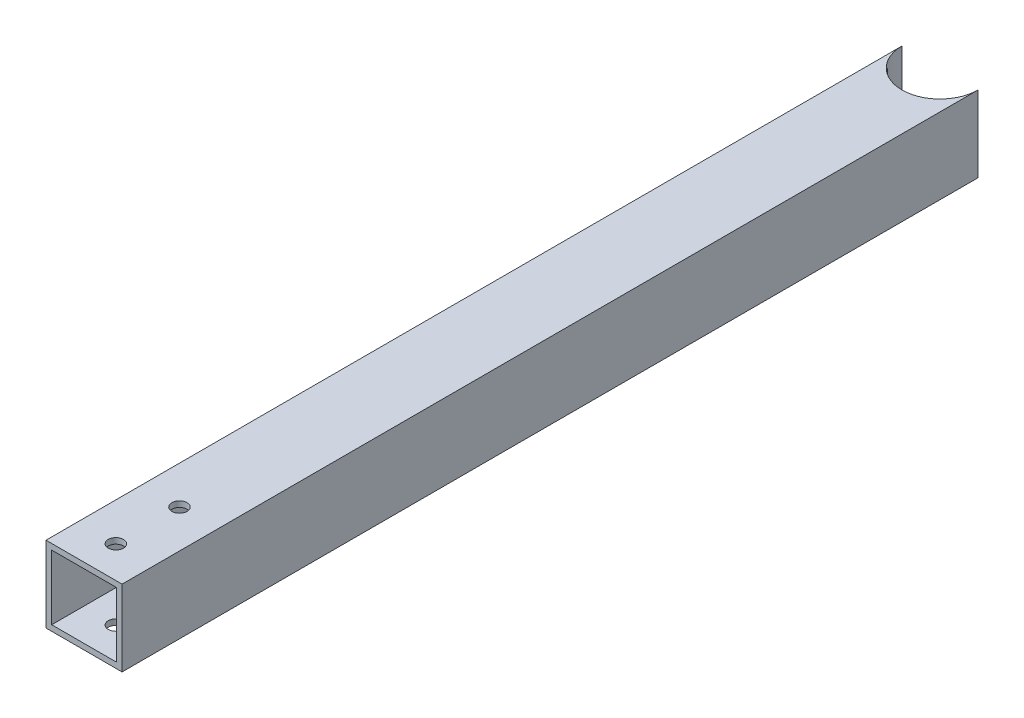
from build123d import *

# Parameters (mm, degrees)
SKETCH1_W           = 40
SKETCH1_H           = 40
SKETCH1_W_2         = 34
SKETCH1_H_2         = 34
BOSS_EXTRUDE1_DEPTH = 450
SKETCH2_R           = 4
SKETCH2_R_2         = 20
CUT_EXTRUDE1_DEPTH  = 600


with BuildPart() as part:
    # Sketch1 → Boss-Extrude1 (new body)
    with BuildSketch(Plane.XY):
        with Locations((20, 20)):
            Rectangle(SKETCH1_W, SKETCH1_H)
        with Locations((20, 20)):
            Rectangle(SKETCH1_W_2, SKETCH1_H_2, mode=Mode.SUBTRACT)
    extrude(amount=BOSS_EXTRUDE1_DEPTH)

    # Sketch2 → Cut-Extrude1 (cut)
    with BuildSketch(Plane(origin=(0, 40, 0), x_dir=(1, 0, 0), z_dir=(0, 1, 0))):
        with Locations(Location((20, -399.819329365, 0), (0, 0, 270))):
            Circle(SKETCH2_R)
        with Locations(Location((20, -433.273109788, 0), (0, 0, 270))):
            Circle(SKETCH2_R)
        with Locations((20, 0)):
            Circle(SKETCH2_R_2)
    extrude(amount=-CUT_EXTRUDE1_DEPTH, mode=Mode.SUBTRACT)


solid = part.part
